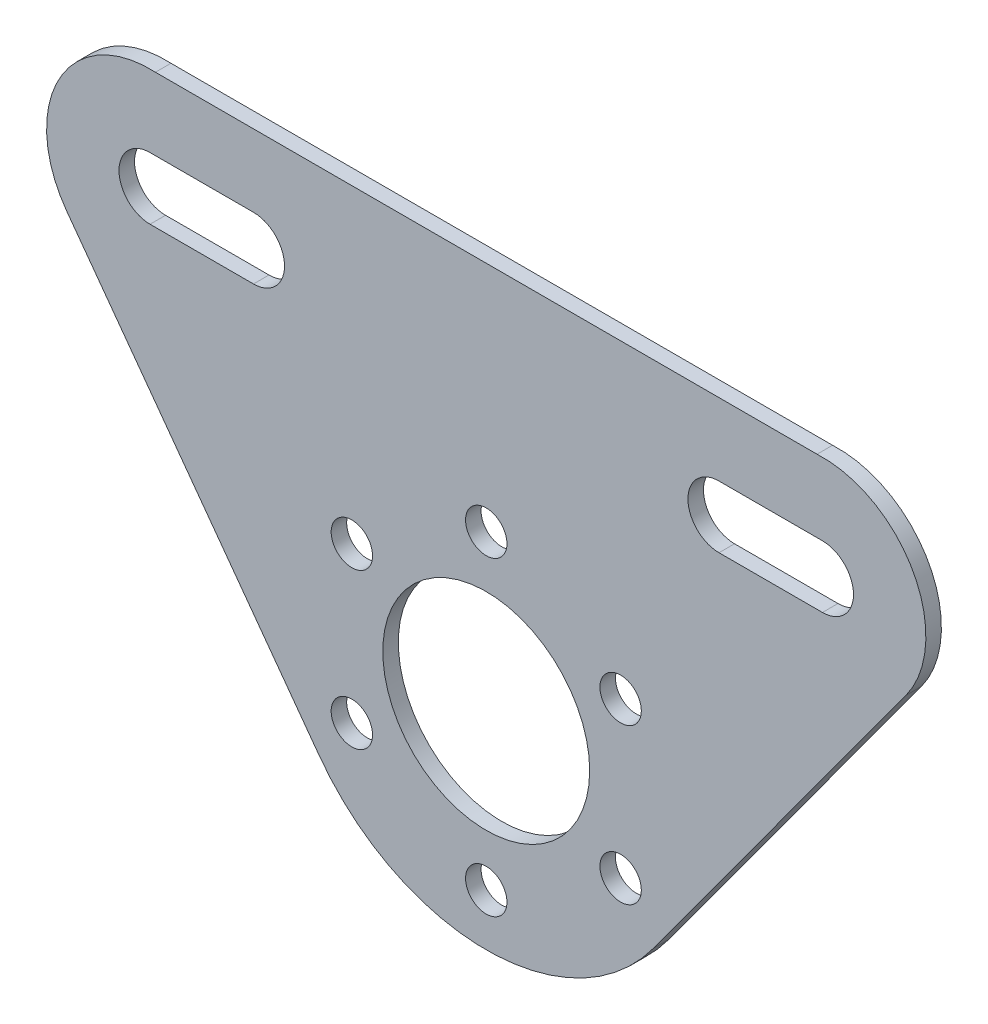
from build123d import *

# Parameters (mm, degrees)
SKETCH1_R           = 20
SKETCH1_R_2         = 4
BOSS_EXTRUDE1_DEPTH = 3


with BuildPart() as part:
    # Sketch1 → Boss-Extrude1 (new body)
    with BuildSketch(Plane.XY):
        with BuildLine():
            Line((-32.287227439, 16.387822118), (-81.143613719, 83.193911059))
            ThreePointArc((-81.143613719, 83.193911059), (-82.591950965, 104.5143713), (-63.956450336, 114.972756547))
            Line((-63.956450336, 114.972756547), (63.956450336, 114.972756547))
            ThreePointArc((63.956450336, 114.972756547), (82.591950965, 104.5143713), (81.143613719, 83.193911059))
            Line((81.143613719, 83.193911059), (32.287227439, 16.387822118))
            ThreePointArc((32.287227439, 16.387822118), (0, 0), (-32.287227439, 16.387822118))
        make_face()
        with Locations((0, 40)):
            Circle(SKETCH1_R, mode=Mode.SUBTRACT)
        with Locations((0, 70)):
            Circle(SKETCH1_R_2, mode=Mode.SUBTRACT)
        with Locations((25.980762114, 55)):
            Circle(SKETCH1_R_2, mode=Mode.SUBTRACT)
        with Locations((25.980762114, 25)):
            Circle(SKETCH1_R_2, mode=Mode.SUBTRACT)
        with Locations((0, 10)):
            Circle(SKETCH1_R_2, mode=Mode.SUBTRACT)
        with Locations((-25.980762114, 25)):
            Circle(SKETCH1_R_2, mode=Mode.SUBTRACT)
        with Locations((-25.980762114, 55)):
            Circle(SKETCH1_R_2, mode=Mode.SUBTRACT)
        with BuildLine():
            Line((-65, 101), (-45, 101))
            ThreePointArc((-45, 101), (-39, 95), (-45, 89))
            Line((-45, 89), (-65, 89))
            ThreePointArc((-65, 89), (-71, 95), (-65, 101))
        make_face(mode=Mode.SUBTRACT)
        with BuildLine():
            Line((65, 101), (45, 101))
            ThreePointArc((45, 101), (39, 95), (45, 89))
            Line((45, 89), (65, 89))
            ThreePointArc((65, 89), (71, 95), (65, 101))
        make_face(mode=Mode.SUBTRACT)
    extrude(amount=BOSS_EXTRUDE1_DEPTH)


solid = part.part
